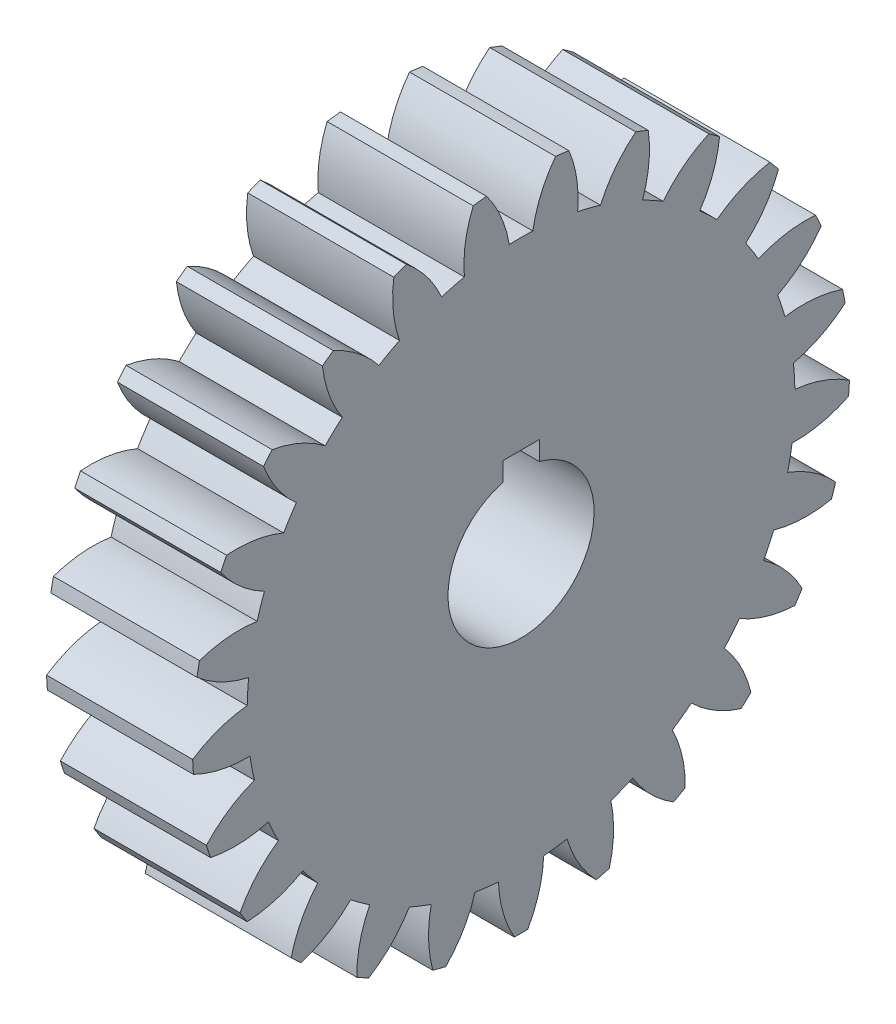
from build123d import *

# Parameters (mm, degrees)
BASPROSKE_W     = 25.4
BASPROSKE_H     = 57.15
TOOTHCUT_DEPTH  = 85.719566807
TEETHCUTS_COUNT = 25
TEETHCUTS_ANGLE = 345.6
BORSKE_R        = 12.7
BORE_DEPTH      = 50.8000508
KEYSKE_W        = 6.35
KEYSKE_H        = 15.5956
KEYWAY_DEPTH    = 50.8000508


with BuildPart() as part:
    # BasProSke → Base-Revolve (revolve)
    with BuildSketch(Plane(origin=(0, 0, 0), x_dir=(1, 0, 0), z_dir=(0, 1, 0)), mode=Mode.PRIVATE) as base_revolve_sk:
        with Locations((12.7, 28.575)):
            Rectangle(BASPROSKE_W, BASPROSKE_H)
    revolve(base_revolve_sk.sketch.rotate(Axis((-10, 0, 0), (1, 0, 0)), 180), axis=Axis((-10, 0, 0), (1, 0, 0)))

    # TooCutSke → ToothCut (cut, through all)
    with BuildSketch(Plane(origin=(0, 0, 0), x_dir=(0, 0, -1), z_dir=(1, 0, 0))):
        with BuildLine():
            ThreePointArc((2.047537683, 47.579693658), (0, 47.62373), (-2.047537683, 47.579693658))
            ThreePointArc((-2.047537683, 47.579693658), (-3.473958384, 52.458910952), (-6.022570076, 56.857321559))
            ThreePointArc((-6.022570076, 56.857321559), (0, 57.1754), (6.022570076, 56.857321559))
            ThreePointArc((6.022570076, 56.857321559), (3.473958384, 52.458910952), (2.047537683, 47.579693658))
        make_face()
    toothcut = extrude(amount=TOOTHCUT_DEPTH, mode=Mode.SUBTRACT)

    # TeethCuts: ToothCut ×25 about axis
    teethcuts_axis = Axis((-10, 0, 0), (1, 0, 0))
    for i in range(1, TEETHCUTS_COUNT):
        add(toothcut.rotate(teethcuts_axis, i * TEETHCUTS_ANGLE / (TEETHCUTS_COUNT - 1)), mode=Mode.SUBTRACT)

    # BorSke → Bore (cut, symmetric)
    with BuildSketch(Plane(origin=(0, 0, 0), x_dir=(0, 0, -1), z_dir=(1, 0, 0))):
        with Locations(Location((0, 0, 0), (0, 0, 180))):
            Circle(BORSKE_R)
    extrude(amount=BORE_DEPTH, both=True, mode=Mode.SUBTRACT)

    # KeySke → Keyway (cut, symmetric)
    with BuildSketch(Plane(origin=(0, 0, 0), x_dir=(0, 0, -1), z_dir=(1, 0, 0))):
        with Locations((0, 7.7978)):
            Rectangle(KEYSKE_W, KEYSKE_H)
    extrude(amount=KEYWAY_DEPTH, both=True, mode=Mode.SUBTRACT)


solid = part.part
